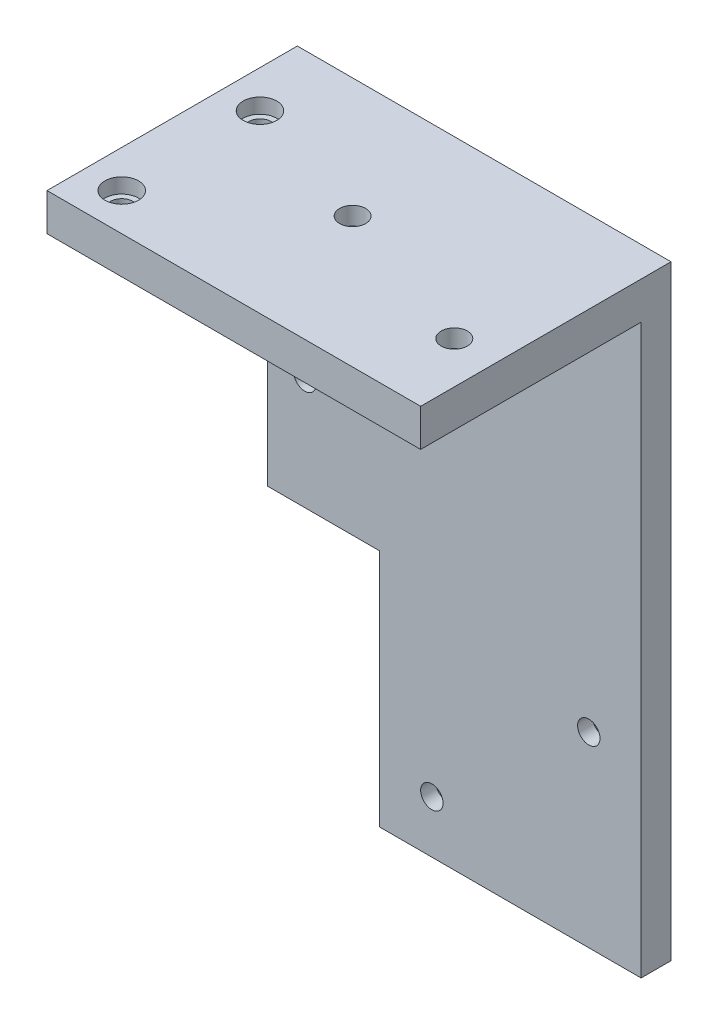
from build123d import *

# Parameters (mm, degrees)
SKETCH_1_W          = 50
SKETCH_1_H          = 29.5
SKETCH_1_R          = 1.75
EXTRUDE_1_DEPTH     = 5
SKETCH_1_17_R       = 3.1
CUT_EXTRUDE_1_DEPTH = 2.6
EXTRUDE_START       = 5
SKETCH_1_18_W       = 50
SKETCH_1_18_H       = 4
SKETCH_1_18_W_2     = 15
EXTRUDE_2_DEPTH     = 49
SKETCH_2_R          = 1.5
CUT_EXTRUDE_2_DEPTH = 76.968743573
SKETCH_2_4_R        = 2.25
CUT_EXTRUDE_3_DEPTH = 2
SKETCH_4_R          = 1.5
CUT_EXTRUDE_4_DEPTH = 75.553671942
SKETCH_4_3_R        = 2.25
CUT_EXTRUDE_5_DEPTH = 2
SKETCH_5_W          = 35
SKETCH_5_H          = 4
EXTRUDE_4_DEPTH     = 32
SKETCH_6_R          = 1.5
CUT_EXTRUDE_6_DEPTH = 97.944571792
SKETCH_6_3_R        = 2.25
CUT_EXTRUDE_7_DEPTH = 2


with BuildPart() as part:
    # 草图1 → 凸台-拉伸1 (new body)
    with BuildSketch(Plane(origin=(0, 0, 0), x_dir=(1, 0, 0), z_dir=(0, 1, 0))):
        with Locations((25, -14.75)):
            Rectangle(SKETCH_1_W, SKETCH_1_H)
        with Locations(Location((23.4, -12, 0), (0, 0, 270))):
            Circle(SKETCH_1_R, mode=Mode.SUBTRACT)
        with Locations(Location((44.400952359, -19.4, 0), (0, 0, 270))):
            Circle(SKETCH_1_R, mode=Mode.SUBTRACT)
    extrude(amount=EXTRUDE_1_DEPTH)

    # 草图1<17> → 切除-拉伸1 (cut)
    with BuildSketch(Plane(origin=(0, 0, 0), x_dir=(1, 0, 0), z_dir=(0, 1, 0))):
        with Locations(Location((23.4, -12, 0), (0, 0, 270))):
            Circle(SKETCH_1_17_R)
        with Locations(Location((44.400952359, -19.4, 0), (0, 0, 270))):
            Circle(SKETCH_1_17_R)
    extrude(amount=CUT_EXTRUDE_1_DEPTH, mode=Mode.SUBTRACT)

    # 草图1<18> → 凸台-拉伸2 (add)
    with BuildSketch(Plane(origin=(0, 0, 0), x_dir=(1, 0, 0), z_dir=(0, 1, 0)).offset(EXTRUDE_START)):
        with Locations((25, 2)):
            Rectangle(SKETCH_1_18_W, SKETCH_1_18_H)
        with Locations((7.5, 2)):
            Rectangle(SKETCH_1_18_W_2, SKETCH_1_18_H)
    extrude(amount=-EXTRUDE_2_DEPTH)

    # 草图2 → 切除-拉伸2 (cut, through all)
    with BuildSketch(Plane(origin=(0, 5, 0), x_dir=(1, 0, 0), z_dir=(0, 1, 0))):
        with Locations(Location((5, -24.5, 0), (0, 0, 270))):
            Circle(SKETCH_2_R)
        with Locations(Location((5, -6, 0), (0, 0, 270))):
            Circle(SKETCH_2_R)
    extrude(amount=-CUT_EXTRUDE_2_DEPTH, mode=Mode.SUBTRACT)

    # 草图2<4> → 切除-拉伸3 (cut)
    with BuildSketch(Plane(origin=(0, 5, 0), x_dir=(1, 0, 0), z_dir=(0, 1, 0))):
        with Locations(Location((5, -24.5, 0), (0, 0, 270))):
            Circle(SKETCH_2_4_R)
        with Locations(Location((5, -6, 0), (0, 0, 270))):
            Circle(SKETCH_2_4_R)
    extrude(amount=-CUT_EXTRUDE_3_DEPTH, mode=Mode.SUBTRACT)

    # 草图4 → 切除-拉伸4 (cut, through all)
    with BuildSketch(Plane(origin=(0, 0, -4), x_dir=(-1, 0, 0), z_dir=(0, 0, -1))):
        with Locations((-5, -29)):
            Circle(SKETCH_4_R)
    extrude(amount=-CUT_EXTRUDE_4_DEPTH, mode=Mode.SUBTRACT)

    # 草图4<3> → 切除-拉伸5 (cut)
    with BuildSketch(Plane(origin=(0, 0, -4), x_dir=(-1, 0, 0), z_dir=(0, 0, -1))):
        with Locations((-5, -29)):
            Circle(SKETCH_4_3_R)
    extrude(amount=-CUT_EXTRUDE_5_DEPTH, mode=Mode.SUBTRACT)

    # 草图5 → 凸台-拉伸4 (add)
    with BuildSketch(Plane.XZ.offset(44)):
        with Locations((32.5, -2)):
            Rectangle(SKETCH_5_W, SKETCH_5_H)
    extrude(amount=EXTRUDE_4_DEPTH)

    # 草图6 → 切除-拉伸6 (cut, through all)
    with BuildSketch(Plane(origin=(0, 0, -4), x_dir=(-1, 0, 0), z_dir=(0, 0, -1))):
        with Locations((-22, -69)):
            Circle(SKETCH_6_R)
        with Locations((-43, -51)):
            Circle(SKETCH_6_R)
    extrude(amount=-CUT_EXTRUDE_6_DEPTH, mode=Mode.SUBTRACT)

    # 草图6<3> → 切除-拉伸7 (cut)
    with BuildSketch(Plane(origin=(0, 0, -4), x_dir=(-1, 0, 0), z_dir=(0, 0, -1))):
        with Locations((-22, -69)):
            Circle(SKETCH_6_3_R)
        with Locations((-43, -51)):
            Circle(SKETCH_6_3_R)
    extrude(amount=-CUT_EXTRUDE_7_DEPTH, mode=Mode.SUBTRACT)


solid = part.part
